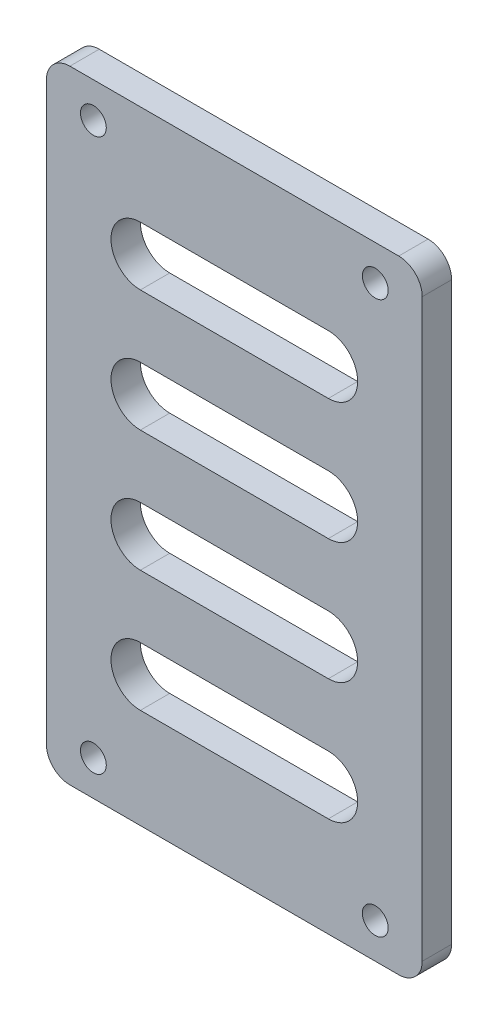
from build123d import *

# Parameters (mm, degrees)
SKETCH1_W           = 32
SKETCH1_H           = 53
SKETCH1_R           = 1.1
BOSS_EXTRUDE1_DEPTH = 2.5
CUT_EXTRUDE2_DEPTH  = 32.056400307
FILLET1_R           = 2


with BuildPart() as part:
    # Sketch1 → Boss-Extrude1 (new body)
    with BuildSketch(Plane.XY):
        Rectangle(SKETCH1_W, SKETCH1_H)
        with Locations((-12, 23.5)):
            Circle(SKETCH1_R, mode=Mode.SUBTRACT)
        with Locations((12, -23.5)):
            Circle(SKETCH1_R, mode=Mode.SUBTRACT)
        with Locations((12, 23.5)):
            Circle(SKETCH1_R, mode=Mode.SUBTRACT)
        with Locations((-12, -23.5)):
            Circle(SKETCH1_R, mode=Mode.SUBTRACT)
    extrude(amount=BOSS_EXTRUDE1_DEPTH)

    # Sketch4 → Cut-Extrude2 (cut, through all)
    with BuildSketch(Plane.XY.offset(2.5)):
        with BuildLine():
            Line((-8, 18), (8, 18))
            ThreePointArc((8, 18), (10.5, 15.5), (8, 13))
            Line((8, 13), (-8, 13))
            ThreePointArc((-8, 13), (-10.5, 15.5), (-8, 18))
        make_face()
        with BuildLine():
            Line((-8, 2.666666667), (8, 2.666666667))
            ThreePointArc((8, 2.666666667), (10.5, 5.166666667), (8, 7.666666667))
            Line((8, 7.666666667), (-8, 7.666666667))
            ThreePointArc((-8, 7.666666667), (-10.5, 5.166666667), (-8, 2.666666667))
        make_face()
        with BuildLine():
            Line((-8, -7.666666667), (8, -7.666666667))
            ThreePointArc((8, -7.666666667), (10.5, -5.166666667), (8, -2.666666667))
            Line((8, -2.666666667), (-8, -2.666666667))
            ThreePointArc((-8, -2.666666667), (-10.5, -5.166666667), (-8, -7.666666667))
        make_face()
        with BuildLine():
            Line((-8, -18), (8, -18))
            ThreePointArc((8, -18), (10.5, -15.5), (8, -13))
            Line((8, -13), (-8, -13))
            ThreePointArc((-8, -13), (-10.5, -15.5), (-8, -18))
        make_face()
    extrude(amount=-CUT_EXTRUDE2_DEPTH, mode=Mode.SUBTRACT)

    # Fillet1
    fillet1_edges = [part.edges().sort_by_distance(p)[0] for p in [
        (16, -26.5, 1.25),
        (-16, -26.5, 1.25),
        (-16, 26.5, 1.25),
        (16, 26.5, 1.25),
    ]]
    fillet(fillet1_edges, radius=FILLET1_R)


solid = part.part
